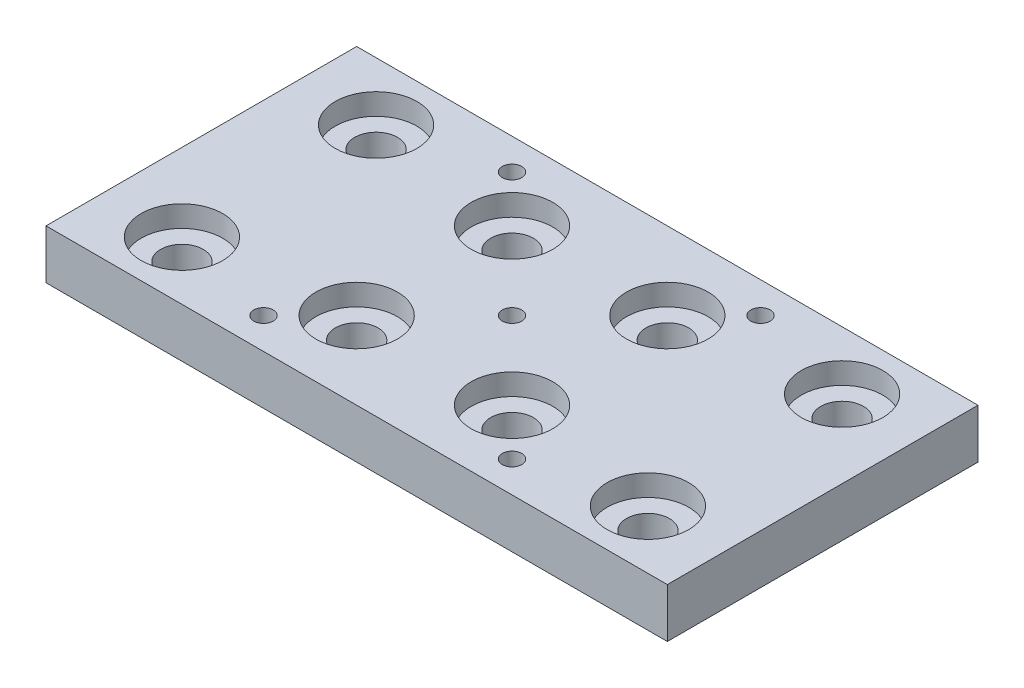
from build123d import *

# Parameters (mm, degrees)
SKETCH1_W                       = 80
SKETCH1_H                       = 40
BOSS_EXTRUDE1_DEPTH             = 6.35
M3X0_5_TAPPED_HOLE2_D           = 2.5
CBORE_FOR_M5_SBHCS1_D           = 5.5
CBORE_FOR_M5_SBHCS1_CBORE_D     = 10.5
CBORE_FOR_M5_SBHCS1_CBORE_DEPTH = 2.75


with BuildPart() as part:
    # Sketch1 → Boss-Extrude1 (new body)
    with BuildSketch(Plane(origin=(0, 0, 0), x_dir=(1, 0, 0), z_dir=(0, 1, 0))):
        Rectangle(SKETCH1_W, SKETCH1_H)
    extrude(amount=BOSS_EXTRUDE1_DEPTH)

    # M3x0.5 Tapped Hole2 (through all)
    with Locations(Plane(origin=(0, 6.35, 0), x_dir=(1, 0, 0), z_dir=(0, 1, 0))):
        with Locations((0, 0), (16, 16), (-16, -16), (-16, 16), (16, -16)):
            Hole(M3X0_5_TAPPED_HOLE2_D / 2)

    # CBORE for M5 SBHCS1 (through all)
    with Locations(Plane(origin=(0, 6.35, 0), x_dir=(1, 0, 0), z_dir=(0, 1, 0))):
        with Locations((10, 10), (30, 12.5), (-30, 12.5), (-10, 10), (30, -12.5), (10, -10), (-10, -10), (-30, -12.5)):
            CounterBoreHole(CBORE_FOR_M5_SBHCS1_D / 2, CBORE_FOR_M5_SBHCS1_CBORE_D / 2, CBORE_FOR_M5_SBHCS1_CBORE_DEPTH)


solid = part.part
